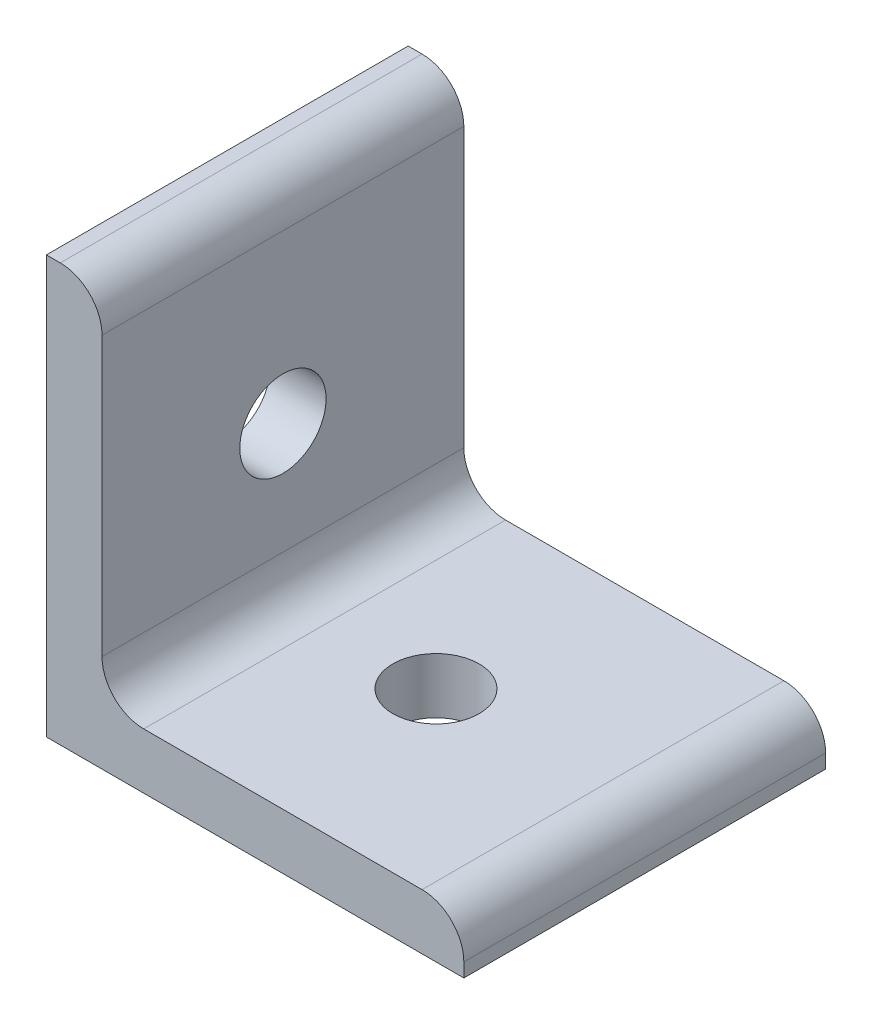
from build123d import *

# Parameters (mm, degrees)
EXTRUDE_1_DEPTH         = 13
HOLE_WIZARD_6_2_6_2_1_D = 6.2
HOLE_WIZARD_6_2_6_2_2_D = 6.2
FILLET_1_R              = 3


with BuildPart() as part:
    # 草图1 → 凸台-拉伸1 (new, symmetric)
    with BuildSketch(Plane.XY):
        Polygon((0, 0), (30, 0), (30, 4), (4, 4), (4, 30), (0, 30), align=None)
    extrude(amount=EXTRUDE_1_DEPTH, both=True)

    # Ø6.2 (6.2) 直径孔1 (through all)
    with Locations(Plane(origin=(0, 4, 0), x_dir=(1, 0, 0), z_dir=(0, 1, 0))):
        with Locations((15, 0)):
            Hole(HOLE_WIZARD_6_2_6_2_1_D / 2)

    # Ø6.2 (6.2) 直径孔2 (through all)
    with Locations(Plane(origin=(4, 0, 0), x_dir=(0, 0, -1), z_dir=(1, 0, 0))):
        with Locations((0, 15)):
            Hole(HOLE_WIZARD_6_2_6_2_2_D / 2)

    # 圆角1
    fillet_1_edges = [part.edges().sort_by_distance(p)[0] for p in [
        (4, 30, 0),
        (4, 4, 0),
        (30, 4, 0),
    ]]
    fillet(fillet_1_edges, radius=FILLET_1_R)


solid = part.part
